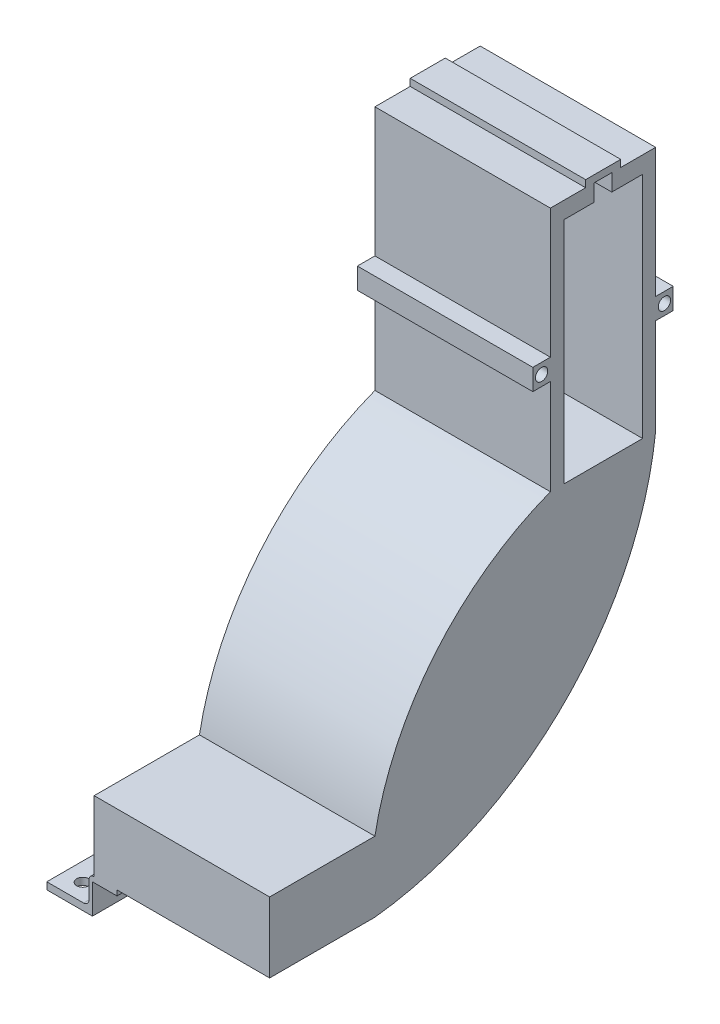
from build123d import *

# Parameters (mm, degrees)
SKETCH1_W            = 20
SKETCH1_H            = 30
BOSS_EXTRUDE1_DEPTH  = 10
SKETCH2_W            = 12
SKETCH2_H            = 8
CUT_EXTRUDE1_DEPTH   = 38.416573868
FILLET1_R            = 1.5
FILLET2_R            = 1.5
SKETCH3_W            = 7
SKETCH3_H            = 8.5
CUT_EXTRUDE2_DEPTH   = 38.416573868
SKETCH4_R            = 1.75
CUT_EXTRUDE3_DEPTH   = 37.932370625
BOSS_EXTRUDE10_DEPTH = 10
SKETCH12_11_R        = 1.75
BOSS_EXTRUDE11_DEPTH = 50
SKETCH12_12_W        = 5
SKETCH12_12_H        = 6
SKETCH12_12_R        = 1.75
BOSS_EXTRUDE12_DEPTH = 50


with BuildPart() as part:
    # Sketch1 → Boss-Extrude1 (new body)
    with BuildSketch(Plane(origin=(0, 0, 0), x_dir=(1, 0, 0), z_dir=(0, 1, 0))):
        with Locations((10, 15)):
            Rectangle(SKETCH1_W, SKETCH1_H)
    extrude(amount=BOSS_EXTRUDE1_DEPTH)

    # Sketch2 → Cut-Extrude1 (cut, through all)
    with BuildSketch(Plane.XY):
        with Locations((6, 6)):
            Rectangle(SKETCH2_W, SKETCH2_H)
    extrude(amount=-CUT_EXTRUDE1_DEPTH, mode=Mode.SUBTRACT)

    # Fillet1
    fillet1_edges = [part.edges().sort_by_distance(p)[0] for p in [
        (12, 2, -15),
    ]]
    fillet(fillet1_edges, radius=FILLET1_R)

    # Fillet2
    fillet2_edges = [part.edges().sort_by_distance(p)[0] for p in [
        (12, 10, -15),
    ]]
    fillet(fillet2_edges, radius=FILLET2_R)

    # Sketch3 → Cut-Extrude2 (cut, through all)
    with BuildSketch(Plane.XY):
        with Locations((16.5, 4.25)):
            Rectangle(SKETCH3_W, SKETCH3_H)
    extrude(amount=-CUT_EXTRUDE2_DEPTH, mode=Mode.SUBTRACT)

    # Sketch4 → Cut-Extrude3 (cut, through all)
    with BuildSketch(Plane(origin=(0, 2, 0), x_dir=(1, 0, 0), z_dir=(0, 1, 0))):
        with Locations((5.25, 25)):
            Circle(SKETCH4_R)
        with Locations((5.25, 5)):
            Circle(SKETCH4_R)
    extrude(amount=-CUT_EXTRUDE3_DEPTH, mode=Mode.SUBTRACT)

    # Sketch12<11> → Boss-Extrude11 (add)
    with BuildSketch(Plane(origin=(13.5, 0, 0), x_dir=(0, 0, -1), z_dir=(1, 0, 0))):
        with BuildLine():
            Line((0, 30), (0, 10))
            Line((0, 10), (30, 10))
            ThreePointArc((30, 10), (84.031242374, 35.968757626), (110, 90))
            Line((110, 90), (110, 117.2))
            Line((110, 117.2), (115, 117.2))
            Line((115, 117.2), (115, 123.2))
            Line((115, 123.2), (110, 123.2))
            Line((110, 123.2), (110, 160))
            Line((110, 160), (100.05, 160))
            Line((100.05, 160), (100.05, 162))
            Line((100.05, 162), (90.05, 162))
            Line((90.05, 162), (90.05, 160))
            Line((90.05, 160), (80, 160))
            Line((80, 160), (80, 123.2))
            Line((80, 123.2), (80, 117.2))
            Line((80, 117.2), (80, 90))
            ThreePointArc((80, 90), (47.180429407, 66.516308827), (30, 30))
            Line((30, 30), (0, 30))
        make_face()
        with Locations((112.5, 120.2)):
            Circle(SKETCH12_11_R, mode=Mode.SUBTRACT)
        Polygon((106.28, 155.2), (106.28, 90), (83.82, 90), (83.82, 155.2), (92.5, 155.2), (92.5, 160), (97.5, 160), (97.5, 155.2), align=None, mode=Mode.SUBTRACT)
    extrude(amount=BOSS_EXTRUDE11_DEPTH)

    # Sketch12<12> → Boss-Extrude12 (add)
    with BuildSketch(Plane(origin=(13.5, 0, 0), x_dir=(0, 0, -1), z_dir=(1, 0, 0))):
        with Locations((77.5, 120.2)):
            Rectangle(SKETCH12_12_W, SKETCH12_12_H)
        with Locations((77.5, 120.2)):
            Circle(SKETCH12_12_R, mode=Mode.SUBTRACT)
    extrude(amount=BOSS_EXTRUDE12_DEPTH)


with BuildPart() as body_2:
    # Sketch12 → Boss-Extrude10 (new body)
    with BuildSketch(Plane(origin=(13.5, 0, 0), x_dir=(0, 0, -1), z_dir=(1, 0, 0))):
        Polygon((106.28, 90), (83.82, 90), (83.82, 155.2), (92.5, 155.2), (92.5, 160), (97.5, 160), (97.5, 155.2), (106.28, 155.2), align=None)
    extrude(amount=BOSS_EXTRUDE10_DEPTH)


solid = Compound([part.part, body_2.part])
